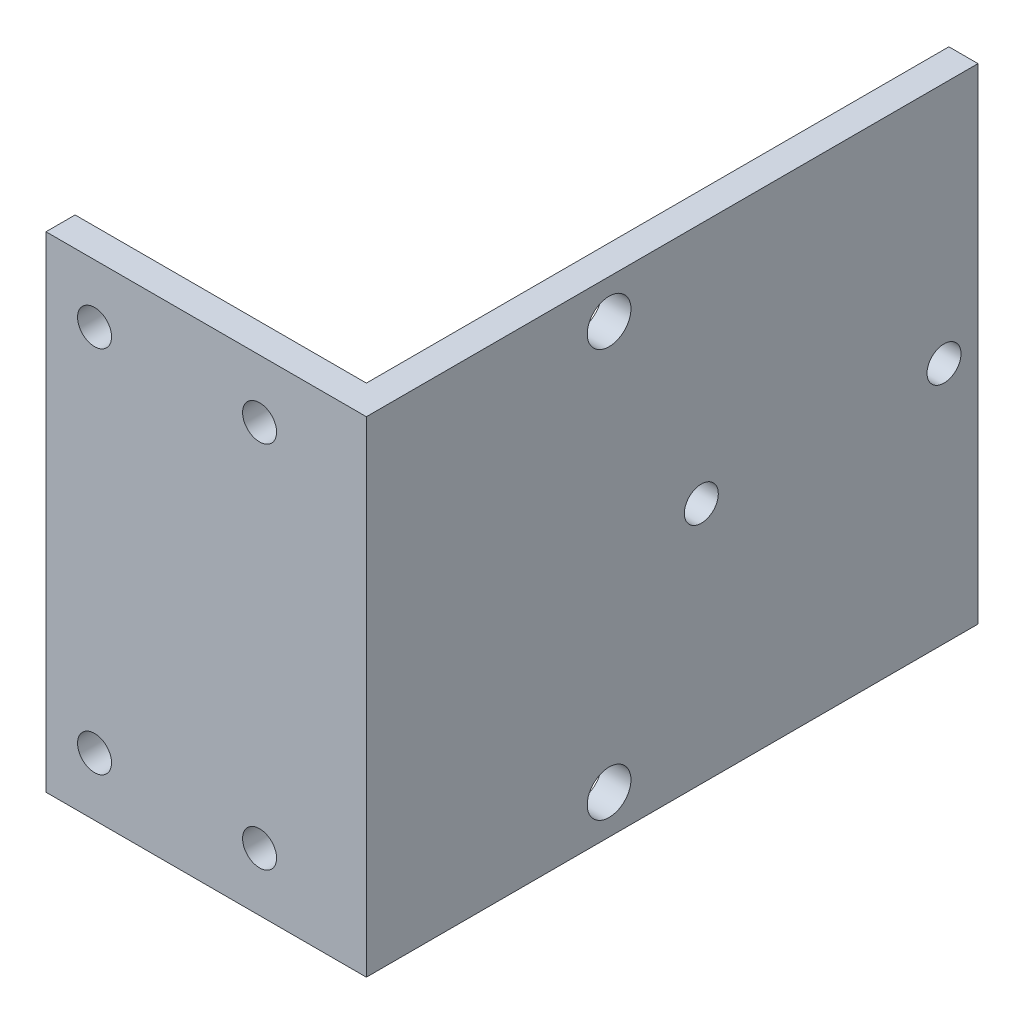
from build123d import *

# Parameters (mm, degrees)
EXTRUDE_1_DEPTH     = 50
SKETCH_2_R          = 1.75
CUT_EXTRUDE_1_DEPTH = 85.787970845
CUT_EXTRUDE_3_REACH = 86.788
SKETCH_4_R          = 1.75
SKETCH_4_R_2        = 2.25


with BuildPart() as part:
    # 草图1 → 凸台-拉伸1 (new body)
    with BuildSketch(Plane(origin=(0, 0, 0), x_dir=(1, 0, 0), z_dir=(0, 1, 0))):
        Polygon((0, 0), (30, 0), (30, 60), (33, 60), (33, -3), (0, -3), align=None)
    extrude(amount=EXTRUDE_1_DEPTH)

    # 草图2 → 切除-拉伸1 (cut, through all)
    with BuildSketch(Plane(origin=(0, 0, 0), x_dir=(-1, 0, 0), z_dir=(0, 0, -1))):
        with Locations((-22, 6)):
            Circle(SKETCH_2_R)
        with Locations((-22, 44)):
            Circle(SKETCH_2_R)
        with Locations((-5, 44)):
            Circle(SKETCH_2_R)
        with Locations((-5, 6)):
            Circle(SKETCH_2_R)
    extrude(amount=-CUT_EXTRUDE_1_DEPTH, mode=Mode.SUBTRACT)

    # 草图4 → 切除-拉伸3 (cut, up to next)
    with BuildSketch(Plane(origin=(33, 0, 0), x_dir=(0, 0, -1), z_dir=(1, 0, 0)), mode=Mode.PRIVATE) as cut_extrude_3_sk1:
        with Locations((56.5, 25)):
            Circle(SKETCH_4_R)
    cut_extrude_3_tool1 = extrude(cut_extrude_3_sk1.sketch, amount=-CUT_EXTRUDE_3_REACH, mode=Mode.PRIVATE) & part.part
    # 草图4 → 切除-拉伸3 (cut, up to next)
    with BuildSketch(Plane(origin=(33, 0, 0), x_dir=(0, 0, -1), z_dir=(1, 0, 0)), mode=Mode.PRIVATE) as cut_extrude_3_sk2:
        with Locations((31.5, 25)):
            Circle(SKETCH_4_R)
    cut_extrude_3_tool2 = extrude(cut_extrude_3_sk2.sketch, amount=-CUT_EXTRUDE_3_REACH, mode=Mode.PRIVATE) & part.part
    # 草图4 → 切除-拉伸3 (cut, up to next)
    with BuildSketch(Plane(origin=(33, 0, 0), x_dir=(0, 0, -1), z_dir=(1, 0, 0)), mode=Mode.PRIVATE) as cut_extrude_3_sk3:
        with Locations((22, 46)):
            Circle(SKETCH_4_R_2)
    cut_extrude_3_tool3 = extrude(cut_extrude_3_sk3.sketch, amount=-CUT_EXTRUDE_3_REACH, mode=Mode.PRIVATE) & part.part
    # 草图4 → 切除-拉伸3 (cut, up to next)
    with BuildSketch(Plane(origin=(33, 0, 0), x_dir=(0, 0, -1), z_dir=(1, 0, 0)), mode=Mode.PRIVATE) as cut_extrude_3_sk4:
        with Locations((22, 4)):
            Circle(SKETCH_4_R_2)
    cut_extrude_3_tool4 = extrude(cut_extrude_3_sk4.sketch, amount=-CUT_EXTRUDE_3_REACH, mode=Mode.PRIVATE) & part.part
    add(cut_extrude_3_tool1.solids().sort_by_distance((33, 25, -56.5))[0], mode=Mode.SUBTRACT)
    add(cut_extrude_3_tool2.solids().sort_by_distance((33, 25, -31.5))[0], mode=Mode.SUBTRACT)
    add(cut_extrude_3_tool3.solids().sort_by_distance((33, 46, -22))[0], mode=Mode.SUBTRACT)
    add(cut_extrude_3_tool4.solids().sort_by_distance((33, 4, -22))[0], mode=Mode.SUBTRACT)


solid = part.part
